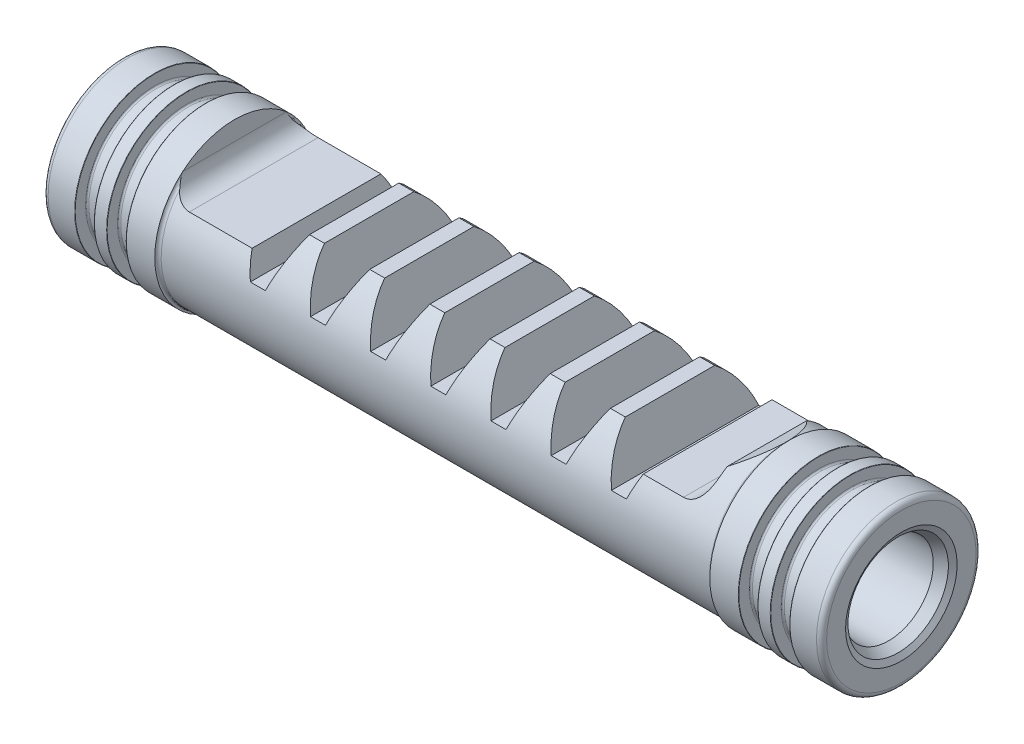
from build123d import *

# Parameters (mm, degrees)
CUT_EXTRUDE_1_DEPTH      = 127.962055884
CUT_EXTRUDE_1_DEPTH_BACK = 127.962055884
CUT_EXTRUDE_3_DEPTH      = 127.962055884
CUT_EXTRUDE_3_DEPTH_BACK = 127.962055884
CUT_EXTRUDE_2_DEPTH      = 127.962055884
PATTERN_LINEAR_2_COUNT   = 7
PATTERN_LINEAR_2_PITCH   = 18.85


with BuildPart() as part:
    # Эскиз1 → Повернуть1 (revolve)
    with BuildSketch(Plane.XY, mode=Mode.PRIVATE) as revolve_1_sk:
        with BuildLine():
            Line((-121.94, 17.464101615), (-121.94, 23.4))
            ThreePointArc((-121.94, 23.4), (-121.47137085, 24.53137085), (-120.34, 25))
            Line((-120.34, 25), (-112.04, 25))
            ThreePointArc((-112.04, 25), (-111.969289322, 24.970710678), (-111.94, 24.9))
            Line((-111.94, 24.9), (-111.94, 21.65))
            ThreePointArc((-111.94, 21.65), (-111.793553391, 21.296446609), (-111.44, 21.15))
            Line((-111.44, 21.15), (-106.44, 21.15))
            ThreePointArc((-106.44, 21.15), (-106.086446609, 21.296446609), (-105.94, 21.65))
            Line((-105.94, 21.65), (-105.94, 24.9))
            ThreePointArc((-105.94, 24.9), (-105.910710678, 24.970710678), (-105.84, 25))
            Line((-105.84, 25), (-102.04, 25))
            ThreePointArc((-102.04, 25), (-101.969289322, 24.970710678), (-101.94, 24.9))
            Line((-101.94, 24.9), (-101.94, 21.65))
            ThreePointArc((-101.94, 21.65), (-101.793553391, 21.296446609), (-101.44, 21.15))
            Line((-101.44, 21.15), (-96.44, 21.15))
            ThreePointArc((-96.44, 21.15), (-96.086446609, 21.296446609), (-95.94, 21.65))
            Line((-95.94, 21.65), (-95.94, 24.9))
            ThreePointArc((-95.94, 24.9), (-95.910710678, 24.970710678), (-95.84, 25))
            Line((-95.84, 25), (-86.94, 25))
            ThreePointArc((-86.94, 25), (-86.647106781, 24.292893219), (-85.94, 24))
            Line((-85.94, 24), (85.94, 24))
            ThreePointArc((85.94, 24), (86.647106781, 24.292893219), (86.94, 25))
            Line((86.94, 25), (95.84, 25))
            ThreePointArc((95.84, 25), (95.910710678, 24.970710678), (95.94, 24.9))
            Line((95.94, 24.9), (95.94, 21.65))
            ThreePointArc((95.94, 21.65), (96.086446609, 21.296446609), (96.44, 21.15))
            Line((96.44, 21.15), (101.44, 21.15))
            ThreePointArc((101.44, 21.15), (101.793553391, 21.296446609), (101.94, 21.65))
            Line((101.94, 21.65), (101.94, 24.9))
            ThreePointArc((101.94, 24.9), (101.969289322, 24.970710678), (102.04, 25))
            Line((102.04, 25), (105.84, 25))
            ThreePointArc((105.84, 25), (105.910710678, 24.970710678), (105.94, 24.9))
            Line((105.94, 24.9), (105.94, 21.65))
            ThreePointArc((105.94, 21.65), (106.086446609, 21.296446609), (106.44, 21.15))
            Line((106.44, 21.15), (111.44, 21.15))
            ThreePointArc((111.44, 21.15), (111.793553391, 21.296446609), (111.94, 21.65))
            Line((111.94, 21.65), (111.94, 24.9))
            ThreePointArc((111.94, 24.9), (111.969289322, 24.970710678), (112.04, 25))
            Line((112.04, 25), (120.34, 25))
            ThreePointArc((120.34, 25), (121.47137085, 24.53137085), (121.94, 23.4))
            Line((121.94, 23.4), (121.94, 17.464101615))
            Line((121.94, 17.464101615), (120.94, 15.732050808))
            Line((120.94, 15.732050808), (117.94, 14))
            Line((117.94, 14), (93.94, 14))
            Line((93.94, 14), (85.857096231, 0))
            Line((85.857096231, 0), (-85.857096231, 0))
            Line((-85.857096231, 0), (-93.94, 14))
            Line((-93.94, 14), (-117.94, 14))
            Line((-117.94, 14), (-120.94, 15.732050808))
            Line((-120.94, 15.732050808), (-121.94, 17.464101615))
        make_face()
    revolve(revolve_1_sk.sketch.rotate(Axis((-137.65589045, 0, 0), (1, 0, 0)), 90), axis=Axis((-137.65589045, 0, 0), (1, 0, 0)))

    # Эскиз3 → Вырез-Вытянуть1 (cut, two sides: drawn at the far end of the back side and taken through both)
    with BuildSketch(Plane.XY.offset(-CUT_EXTRUDE_1_DEPTH_BACK)):
        with BuildLine():
            Line((-86.94, 25), (-86.94, 19))
            ThreePointArc((-86.94, 19), (-85.182640687, 14.757359313), (-80.94, 13))
            Line((-80.94, 13), (-51.84, 13))
            Line((-51.84, 13), (-51.84, 19.5))
            Line((-51.84, 19.5), (51.84, 19.5))
            Line((51.84, 19.5), (51.84, 13))
            Line((51.84, 13), (73.877822174, 13))
            ThreePointArc((73.877822174, 13), (78.120462861, 14.757359313), (79.877822174, 19))
            Line((79.877822174, 19), (79.877822174, 20.5))
            Line((79.877822174, 20.5), (85.94, 24))
            Line((85.94, 24), (85.94, 25))
            Line((85.94, 25), (-86.94, 25))
        make_face()
    extrude(amount=CUT_EXTRUDE_1_DEPTH + CUT_EXTRUDE_1_DEPTH_BACK, mode=Mode.SUBTRACT)

    # Эскиз5 → Вырез-Вытянуть3 (cut, two sides: drawn at the far end of the back side and taken through both)
    with BuildSketch(Plane.XY.offset(-CUT_EXTRUDE_3_DEPTH_BACK)):
        with BuildLine():
            Line((-48.351702841, -24), (-39.64, -17.9))
            Line((-39.64, -17.9), (-24.64, -17.9))
            Line((-24.64, -17.9), (-14.74908129, -21.5))
            Line((-14.74908129, -21.5), (91.94, -21.5))
            Line((91.94, -21.5), (91.94, -24))
            ThreePointArc((91.94, -24), (92.232893219, -24.707106781), (92.94, -25))
            Line((92.94, -25), (-48.351702841, -25))
            Line((-48.351702841, -25), (-48.351702841, -24))
        make_face()
    extrude(amount=CUT_EXTRUDE_3_DEPTH + CUT_EXTRUDE_3_DEPTH_BACK, mode=Mode.SUBTRACT)

    # Эскиз4 → Вырез-Вытянуть2 (cut, symmetric)
    with BuildSketch(Plane.XY):
        Polygon((-54.205806523, 6.5), (-49.474193477, 19.5), (-63.630806523, 19.5), (-58.899193477, 6.5), align=None)
    cut_extrude_2 = extrude(amount=CUT_EXTRUDE_2_DEPTH, both=True, mode=Mode.SUBTRACT)

    # Линейный массив2: Вырез-Вытянуть2 ×7
    with Locations(*[(i * PATTERN_LINEAR_2_PITCH, 0, 0) for i in range(1, PATTERN_LINEAR_2_COUNT)]):
        add(cut_extrude_2, mode=Mode.SUBTRACT)


solid = part.part
